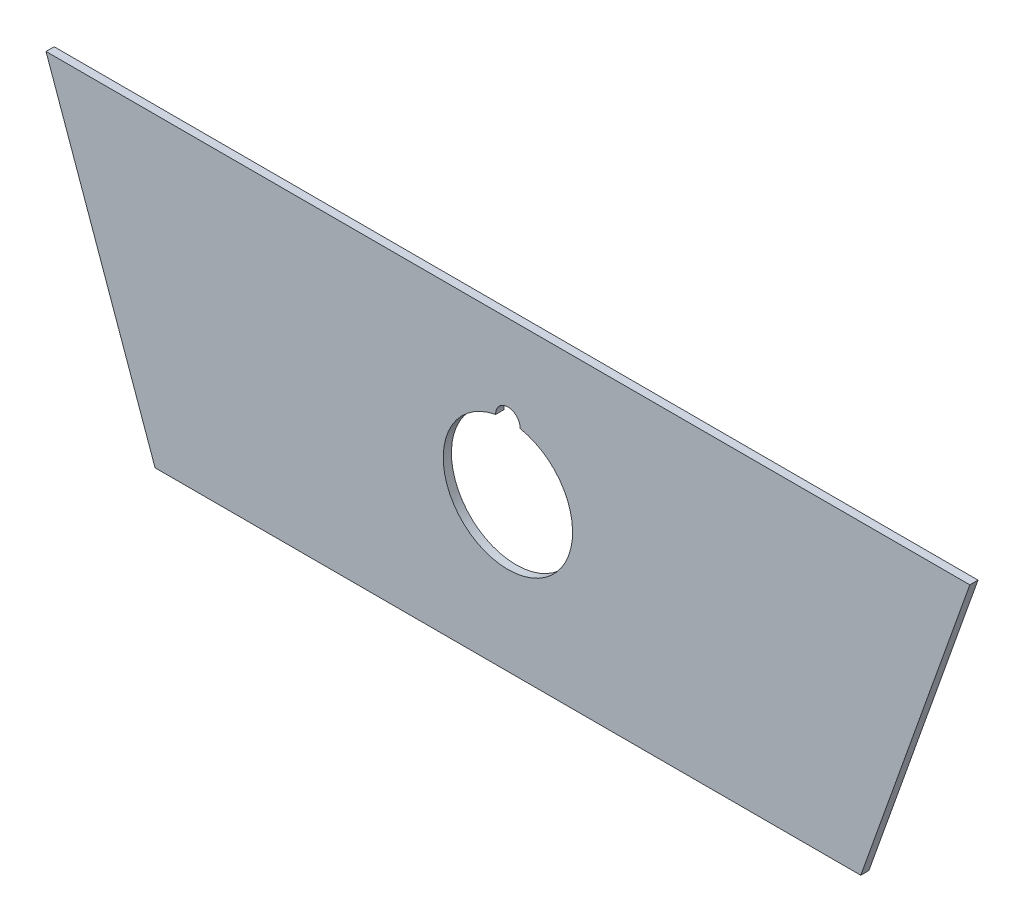
from build123d import *

# Parameters (mm, degrees)
SKETCH1_W           = 115
SKETCH1_H           = 38.1
BOSS_EXTRUDE1_DEPTH = 1.016
CUT_EXTRUDE2_DEPTH  = 61.582049784


with BuildPart() as part:
    # Sketch1 → Boss-Extrude1 (new body)
    with BuildSketch(Plane.XY):
        Rectangle(SKETCH1_W, SKETCH1_H)
    extrude(amount=BOSS_EXTRUDE1_DEPTH)

    # Sketch2 → Cut-Extrude2 (cut, through all)
    with BuildSketch(Plane.XY):
        Polygon((-57.5, 19.05), (-57.5, -19.05), (-43.921959921, -19.05), align=None)
        Polygon((57.5, -19.05), (57.5, 19.05), (43.921959921, -19.05), align=None)
        with BuildLine():
            ThreePointArc((-1.524320269, 7.904362604), (0, -8.050000029), (1.524320269, 7.904362604))
            ThreePointArc((1.524320269, 7.904362604), (0, 9.475003402), (-1.524320269, 7.904362604))
        make_face()
    extrude(amount=CUT_EXTRUDE2_DEPTH, mode=Mode.SUBTRACT)


solid = part.part
